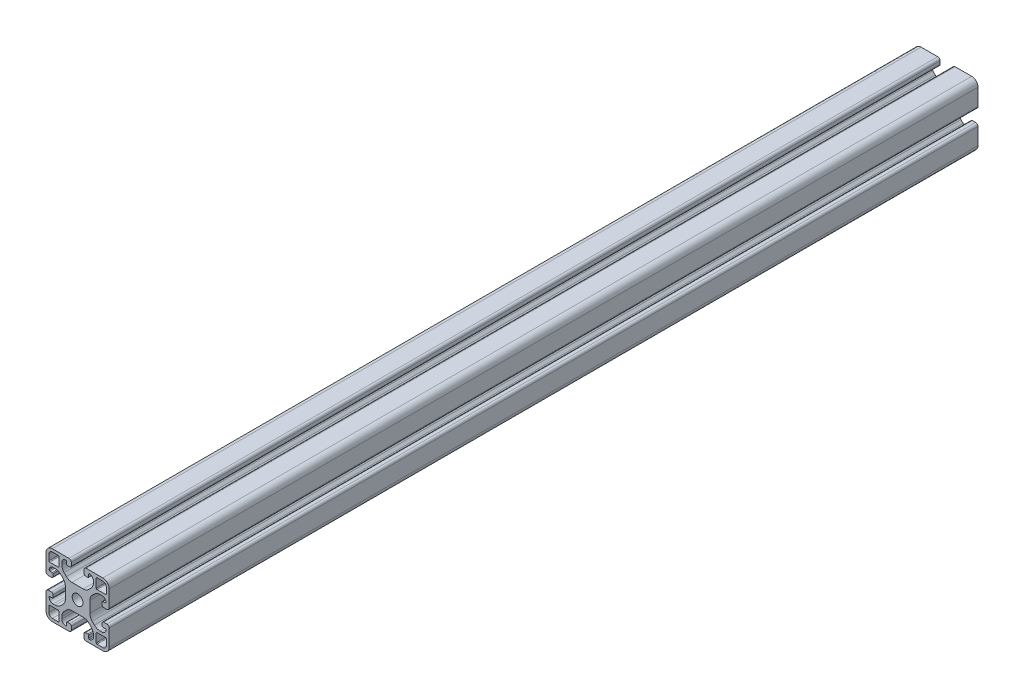
from build123d import *

# Parameters (mm, degrees)
ESQUISSE1_R        = 3.4
BOSS_EXTRU_1_DEPTH = 550


with BuildPart() as part:
    # Esquisse1 → Boss.-Extru.1 (new body)
    with BuildSketch(Plane(origin=(0, 0, -30), x_dir=(-1, 0, 0), z_dir=(0, 0, -1))):
        with BuildLine():
            Line((-4.5, 15), (-4.5, 13.5))
            ThreePointArc((-4.5, 13.5), (-4.353553391, 13.146446609), (-4, 13))
            Line((-4, 13), (-2.5, 13))
            ThreePointArc((-2.5, 13), (-2.146446609, 12.853553391), (-2, 12.5))
            ThreePointArc((-2, 12.5), (-2.732233047, 10.732233047), (-4.5, 10))
            Line((-4.5, 10), (-5.807611845, 10))
            ThreePointArc((-5.807611845, 10), (-7.721029006, 10.380602337), (-9.343145751, 11.464466094))
            Line((-9.343145751, 11.464466094), (-10.785533906, 12.906854249))
            ThreePointArc((-10.785533906, 12.906854249), (-11.869397663, 14.528970994), (-12.25, 16.442388155))
            Line((-12.25, 16.442388155), (-12.25, 23.557611845))
            ThreePointArc((-12.25, 23.557611845), (-11.869397663, 25.471029006), (-10.785533906, 27.093145751))
            Line((-10.785533906, 27.093145751), (-9.343145751, 28.535533906))
            ThreePointArc((-9.343145751, 28.535533906), (-7.721029006, 29.619397663), (-5.807611845, 30))
            Line((-5.807611845, 30), (-4.5, 30))
            ThreePointArc((-4.5, 30), (-2.732233047, 29.267766953), (-2, 27.5))
            ThreePointArc((-2, 27.5), (-2.146446609, 27.146446609), (-2.5, 27))
            Line((-2.5, 27), (-4, 27))
            ThreePointArc((-4, 27), (-4.353553391, 26.853553391), (-4.5, 26.5))
            Line((-4.5, 26.5), (-4.5, 25))
            ThreePointArc((-4.5, 25), (-4.207106781, 24.292893219), (-3.5, 24))
            Line((-3.5, 24), (-1.5, 24))
            ThreePointArc((-1.5, 24), (-0.439339828, 24.439339828), (0, 25.5))
            Line((0, 25.5), (0, 36))
            ThreePointArc((0, 36), (-1.171572875, 38.828427125), (-4, 40))
            Line((-4, 40), (-14.5, 40))
            ThreePointArc((-14.5, 40), (-15.560660172, 39.560660172), (-16, 38.5))
            Line((-16, 38.5), (-16, 36.5))
            ThreePointArc((-16, 36.5), (-15.707106781, 35.792893219), (-15, 35.5))
            Line((-15, 35.5), (-13.5, 35.5))
            ThreePointArc((-13.5, 35.5), (-13.146446609, 35.646446609), (-13, 36))
            Line((-13, 36), (-13, 37.5))
            ThreePointArc((-13, 37.5), (-12.853553391, 37.853553391), (-12.5, 38))
            ThreePointArc((-12.5, 38), (-10.732233047, 37.267766953), (-10, 35.5))
            Line((-10, 35.5), (-10, 34.192388155))
            ThreePointArc((-10, 34.192388155), (-10.380602337, 32.278970994), (-11.464466094, 30.656854249))
            Line((-11.464466094, 30.656854249), (-12.906854249, 29.214466094))
            ThreePointArc((-12.906854249, 29.214466094), (-14.528970994, 28.130602337), (-16.442388155, 27.75))
            Line((-16.442388155, 27.75), (-23.557611845, 27.75))
            ThreePointArc((-23.557611845, 27.75), (-25.471029006, 28.130602337), (-27.093145751, 29.214466094))
            Line((-27.093145751, 29.214466094), (-28.535533906, 30.656854249))
            ThreePointArc((-28.535533906, 30.656854249), (-29.619397663, 32.278970994), (-30, 34.192388155))
            Line((-30, 34.192388155), (-30, 35.5))
            ThreePointArc((-30, 35.5), (-29.267766953, 37.267766953), (-27.5, 38))
            ThreePointArc((-27.5, 38), (-27.146446609, 37.853553391), (-27, 37.5))
            Line((-27, 37.5), (-27, 36))
            ThreePointArc((-27, 36), (-26.853553391, 35.646446609), (-26.5, 35.5))
            Line((-26.5, 35.5), (-25, 35.5))
            ThreePointArc((-25, 35.5), (-24.292893219, 35.792893219), (-24, 36.5))
            Line((-24, 36.5), (-24, 38.5))
            ThreePointArc((-24, 38.5), (-24.439339828, 39.560660172), (-25.5, 40))
            Line((-25.5, 40), (-36, 40))
            ThreePointArc((-36, 40), (-38.828427125, 38.828427125), (-40, 36))
            Line((-40, 36), (-40, 25.5))
            ThreePointArc((-40, 25.5), (-39.560660172, 24.439339828), (-38.5, 24))
            Line((-38.5, 24), (-36.5, 24))
            ThreePointArc((-36.5, 24), (-35.792893219, 24.292893219), (-35.5, 25))
            Line((-35.5, 25), (-35.5, 26.5))
            ThreePointArc((-35.5, 26.5), (-35.646446609, 26.853553391), (-36, 27))
            Line((-36, 27), (-37.5, 27))
            ThreePointArc((-37.5, 27), (-37.853553391, 27.146446609), (-38, 27.5))
            ThreePointArc((-38, 27.5), (-37.267766953, 29.267766953), (-35.5, 30))
            Line((-35.5, 30), (-34.192388155, 30))
            ThreePointArc((-34.192388155, 30), (-32.278970994, 29.619397663), (-30.656854249, 28.535533906))
            Line((-30.656854249, 28.535533906), (-29.214466094, 27.093145751))
            ThreePointArc((-29.214466094, 27.093145751), (-28.130602337, 25.471029006), (-27.75, 23.557611845))
            Line((-27.75, 23.557611845), (-27.75, 16.442388155))
            ThreePointArc((-27.75, 16.442388155), (-28.130602337, 14.528970994), (-29.214466094, 12.906854249))
            Line((-29.214466094, 12.906854249), (-30.656854249, 11.464466094))
            ThreePointArc((-30.656854249, 11.464466094), (-32.278970994, 10.380602337), (-34.192388155, 10))
            Line((-34.192388155, 10), (-35.5, 10))
            ThreePointArc((-35.5, 10), (-37.267766953, 10.732233047), (-38, 12.5))
            ThreePointArc((-38, 12.5), (-37.853553391, 12.853553391), (-37.5, 13))
            Line((-37.5, 13), (-36, 13))
            ThreePointArc((-36, 13), (-35.646446609, 13.146446609), (-35.5, 13.5))
            Line((-35.5, 13.5), (-35.5, 15))
            ThreePointArc((-35.5, 15), (-35.792893219, 15.707106781), (-36.5, 16))
            Line((-36.5, 16), (-38.5, 16))
            ThreePointArc((-38.5, 16), (-39.560660172, 15.560660172), (-40, 14.5))
            Line((-40, 14.5), (-40, 4))
            ThreePointArc((-40, 4), (-38.828427125, 1.171572875), (-36, 0))
            Line((-36, 0), (-25.5, 0))
            ThreePointArc((-25.5, 0), (-24.439339828, 0.439339828), (-24, 1.5))
            Line((-24, 1.5), (-24, 3.5))
            ThreePointArc((-24, 3.5), (-24.292893219, 4.207106781), (-25, 4.5))
            Line((-25, 4.5), (-26.5, 4.5))
            ThreePointArc((-26.5, 4.5), (-26.853553391, 4.353553391), (-27, 4))
            Line((-27, 4), (-27, 2.5))
            ThreePointArc((-27, 2.5), (-27.146446609, 2.146446609), (-27.5, 2))
            ThreePointArc((-27.5, 2), (-29.267766953, 2.732233047), (-30, 4.5))
            Line((-30, 4.5), (-30, 5.807611845))
            ThreePointArc((-30, 5.807611845), (-29.619397663, 7.721029006), (-28.535533906, 9.343145751))
            Line((-28.535533906, 9.343145751), (-27.093145751, 10.785533906))
            ThreePointArc((-27.093145751, 10.785533906), (-25.471029006, 11.869397663), (-23.557611845, 12.25))
            Line((-23.557611845, 12.25), (-16.442388155, 12.25))
            ThreePointArc((-16.442388155, 12.25), (-14.528970994, 11.869397663), (-12.906854249, 10.785533906))
            Line((-12.906854249, 10.785533906), (-11.464466094, 9.343145751))
            ThreePointArc((-11.464466094, 9.343145751), (-10.380602337, 7.721029006), (-10, 5.807611845))
            Line((-10, 5.807611845), (-10, 4.5))
            ThreePointArc((-10, 4.5), (-10.732233047, 2.732233047), (-12.5, 2))
            ThreePointArc((-12.5, 2), (-12.853553391, 2.146446609), (-13, 2.5))
            Line((-13, 2.5), (-13, 4))
            ThreePointArc((-13, 4), (-13.146446609, 4.353553391), (-13.5, 4.5))
            Line((-13.5, 4.5), (-15, 4.5))
            ThreePointArc((-15, 4.5), (-15.707106781, 4.207106781), (-16, 3.5))
            Line((-16, 3.5), (-16, 1.5))
            ThreePointArc((-16, 1.5), (-15.560660172, 0.439339828), (-14.5, 0))
            Line((-14.5, 0), (-4, 0))
            ThreePointArc((-4, 0), (-1.171572875, 1.171572875), (0, 4))
            Line((0, 4), (0, 14.5))
            ThreePointArc((0, 14.5), (-0.439339828, 15.560660172), (-1.5, 16))
            Line((-1.5, 16), (-3.5, 16))
            ThreePointArc((-3.5, 16), (-4.207106781, 15.707106781), (-4.5, 15))
        make_face()
        with Locations(Location((-20, 20, 0), (0, 0, 180))):
            Circle(ESQUISSE1_R, mode=Mode.SUBTRACT)
        with BuildLine():
            Line((-4, 1.8), (-7.7, 1.8))
            ThreePointArc((-7.7, 1.8), (-8.053553391, 1.946446609), (-8.2, 2.3))
            Line((-8.2, 2.3), (-8.2, 7.7))
            ThreePointArc((-8.2, 7.7), (-8.053553391, 8.053553391), (-7.7, 8.2))
            Line((-7.7, 8.2), (-2.3, 8.2))
            ThreePointArc((-2.3, 8.2), (-1.946446609, 8.053553391), (-1.8, 7.7))
            Line((-1.8, 7.7), (-1.8, 4))
            ThreePointArc((-1.8, 4), (-2.444365081, 2.444365081), (-4, 1.8))
        make_face(mode=Mode.SUBTRACT)
        with BuildLine():
            Line((-38.2, 4), (-38.2, 7.7))
            ThreePointArc((-38.2, 7.7), (-38.053553391, 8.053553391), (-37.7, 8.2))
            Line((-37.7, 8.2), (-32.3, 8.2))
            ThreePointArc((-32.3, 8.2), (-31.946446609, 8.053553391), (-31.8, 7.7))
            Line((-31.8, 7.7), (-31.8, 2.3))
            ThreePointArc((-31.8, 2.3), (-31.946446609, 1.946446609), (-32.3, 1.8))
            Line((-32.3, 1.8), (-36, 1.8))
            ThreePointArc((-36, 1.8), (-37.555634919, 2.444365081), (-38.2, 4))
        make_face(mode=Mode.SUBTRACT)
        with BuildLine():
            Line((-36, 38.2), (-32.3, 38.2))
            ThreePointArc((-32.3, 38.2), (-31.946446609, 38.053553391), (-31.8, 37.7))
            Line((-31.8, 37.7), (-31.8, 32.3))
            ThreePointArc((-31.8, 32.3), (-31.946446609, 31.946446609), (-32.3, 31.8))
            Line((-32.3, 31.8), (-37.7, 31.8))
            ThreePointArc((-37.7, 31.8), (-38.053553391, 31.946446609), (-38.2, 32.3))
            Line((-38.2, 32.3), (-38.2, 36))
            ThreePointArc((-38.2, 36), (-37.555634919, 37.555634919), (-36, 38.2))
        make_face(mode=Mode.SUBTRACT)
        with BuildLine():
            Line((-1.8, 36), (-1.8, 32.3))
            ThreePointArc((-1.8, 32.3), (-1.946446609, 31.946446609), (-2.3, 31.8))
            Line((-2.3, 31.8), (-7.7, 31.8))
            ThreePointArc((-7.7, 31.8), (-8.053553391, 31.946446609), (-8.2, 32.3))
            Line((-8.2, 32.3), (-8.2, 37.7))
            ThreePointArc((-8.2, 37.7), (-8.053553391, 38.053553391), (-7.7, 38.2))
            Line((-7.7, 38.2), (-4, 38.2))
            ThreePointArc((-4, 38.2), (-2.444365081, 37.555634919), (-1.8, 36))
        make_face(mode=Mode.SUBTRACT)
    extrude(amount=-BOSS_EXTRU_1_DEPTH)


solid = part.part
